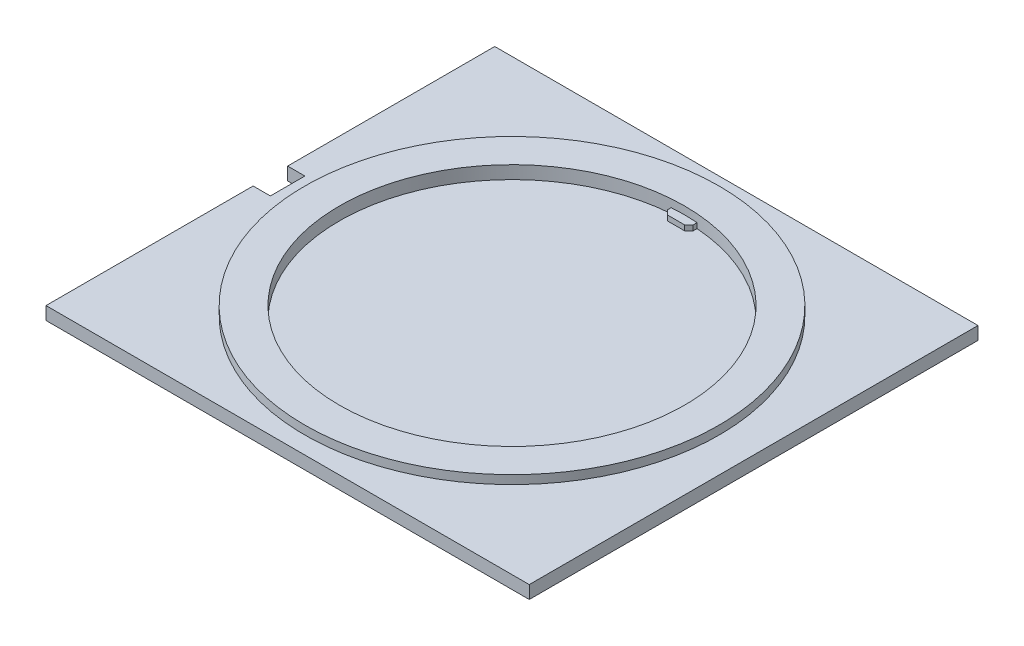
from build123d import *

# Parameters (mm, degrees)
SKETCH1_R           = 24
SKETCH1_R_2         = 20
BOSS_EXTRUDE1_DEPTH = 2.5
SKETCH2_R           = 24
BOSS_EXTRUDE2_DEPTH = 1
SKETCH3_W           = 56
SKETCH3_H           = 52
SKETCH3_R           = 24
BOSS_EXTRUDE3_DEPTH = 1.5
BOSS_EXTRUDE4_DEPTH = 0.6
CHAMFER1_SIZE       = 0.5
SKETCH5_W           = 18.188296091
SKETCH5_H           = 4
CUT_EXTRUDE1_DEPTH  = 39.291643997


with BuildPart() as part:
    # Sketch1 → Boss-Extrude1 (new body)
    with BuildSketch(Plane(origin=(0, 0, 0), x_dir=(1, 0, 0), z_dir=(0, 1, 0))):
        with Locations(Location((0, 0, 0), (0, 0, 270))):
            Circle(SKETCH1_R)
        with Locations(Location((0, 0, 0), (0, 0, 270))):
            Circle(SKETCH1_R_2, mode=Mode.SUBTRACT)
    extrude(amount=BOSS_EXTRUDE1_DEPTH)

    # Sketch2 → Boss-Extrude2 (add)
    with BuildSketch(Plane.XZ):
        with Locations(Location((0, 0, 0), (0, 0, 90))):
            Circle(SKETCH2_R)
    extrude(amount=-BOSS_EXTRUDE2_DEPTH)

    # Sketch3 → Boss-Extrude3 (add)
    with BuildSketch(Plane.XZ):
        Rectangle(SKETCH3_W, SKETCH3_H)
        with Locations(Location((0, 0, 0), (0, 0, 270))):
            Circle(SKETCH3_R, mode=Mode.SUBTRACT)
    extrude(amount=-BOSS_EXTRUDE3_DEPTH)

    # Sketch4 → Boss-Extrude4 (add)
    with BuildSketch(Plane(origin=(0, 1, 0), x_dir=(1, 0, 0), z_dir=(0, 1, 0))):
        with BuildLine():
            Line((1.5, 19), (1.5, 19.943670675))
            ThreePointArc((1.5, 19.943670675), (0, 20), (-1.5, 19.943670675))
            Line((-1.5, 19.943670675), (-1.5, 19))
            Line((-1.5, 19), (1.5, 19))
        make_face()
    extrude(amount=BOSS_EXTRUDE4_DEPTH)

    # Chamfer1
    chamfer1_edges = [part.edges().sort_by_distance(p)[0] for p in [
        (-1.5, 1.3, -19),
        (1.5, 1.3, -19),
    ]]
    chamfer(chamfer1_edges, length=CHAMFER1_SIZE)

    # Sketch5 → Cut-Extrude1 (cut, through all)
    with BuildSketch(Plane.XZ):
        with Locations((-35.094148046, 0)):
            Rectangle(SKETCH5_W, SKETCH5_H)
    extrude(amount=-CUT_EXTRUDE1_DEPTH, mode=Mode.SUBTRACT)


solid = part.part
